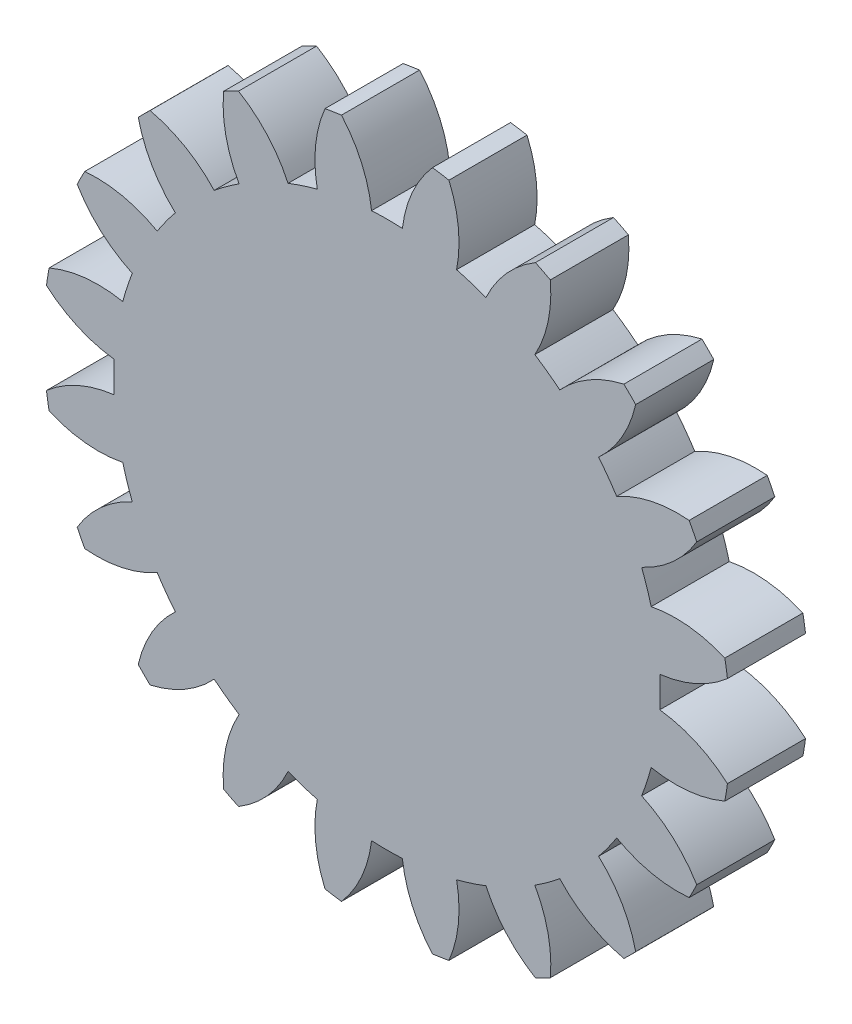
from build123d import *

# Parameters (mm, degrees)
BOSS_EXTRUDE1_DEPTH = 5


with BuildPart() as part:
    # Sketch1 → Boss-Extrude1 (new body)
    with BuildSketch(Plane.XY):
        with BuildLine():
            ThreePointArc((-21.806333941, 2.912696354), (-19.784848102, 1.620704589), (-17.471189616, 0.986171591))
            ThreePointArc((-17.471189616, 0.986171591), (-17.499, 0), (-17.471189616, -0.986171591))
            ThreePointArc((-17.471189616, -0.986171591), (-19.784848102, -1.620704589), (-21.806333941, -2.912696354))
            ThreePointArc((-21.806333941, -2.912696354), (-21.729143493, -3.441558231), (-21.639128664, -3.968388926))
            ThreePointArc((-21.639128664, -3.968388926), (-19.317333972, -4.572472634), (-16.920832513, -4.460989585))
            ThreePointArc((-16.920832513, -4.460989585), (-16.642537979, -5.407488385), (-16.31134495, -6.336799421))
            ThreePointArc((-16.31134495, -6.336799421), (-18.31568345, -7.655235955), (-19.838983319, -9.50866662))
            ThreePointArc((-19.838983319, -9.50866662), (-19.602143532, -9.987790994), (-19.353734704, -10.461020648))
            ThreePointArc((-19.353734704, -10.461020648), (-16.958904602, -10.318064378), (-14.714146429, -9.471478019))
            ThreePointArc((-14.714146429, -9.471478019), (-14.156988385, -10.28565413), (-13.554832194, -11.067137173))
            ThreePointArc((-13.554832194, -11.067137173), (-15.05365209, -12.940419489), (-15.929654782, -15.173862347))
            ThreePointArc((-15.929654782, -15.173862347), (-15.556349186, -15.556349186), (-15.173862347, -15.929654782))
            ThreePointArc((-15.173862347, -15.929654782), (-12.940419489, -15.05365209), (-11.067137173, -13.554832194))
            ThreePointArc((-11.067137173, -13.554832194), (-10.28565413, -14.156988385), (-9.471478019, -14.714146429))
            ThreePointArc((-9.471478019, -14.714146429), (-10.318064378, -16.958904602), (-10.461020648, -19.353734704))
            ThreePointArc((-10.461020648, -19.353734704), (-9.987790994, -19.602143532), (-9.50866662, -19.838983319))
            ThreePointArc((-9.50866662, -19.838983319), (-7.655235955, -18.31568345), (-6.336799421, -16.31134495))
            ThreePointArc((-6.336799421, -16.31134495), (-5.407488385, -16.642537979), (-4.460989585, -16.920832513))
            ThreePointArc((-4.460989585, -16.920832513), (-4.572472634, -19.317333972), (-3.968388926, -21.639128664))
            ThreePointArc((-3.968388926, -21.639128664), (-3.441558231, -21.729143493), (-2.912696354, -21.806333941))
            ThreePointArc((-2.912696354, -21.806333941), (-1.620704589, -19.784848102), (-0.986171591, -17.471189616))
            ThreePointArc((-0.986171591, -17.471189616), (0, -17.499), (0.986171591, -17.471189616))
            ThreePointArc((0.986171591, -17.471189616), (1.620704589, -19.784848102), (2.912696354, -21.806333941))
            ThreePointArc((2.912696354, -21.806333941), (3.441558231, -21.729143493), (3.968388926, -21.639128664))
            ThreePointArc((3.968388926, -21.639128664), (4.572472634, -19.317333972), (4.460989585, -16.920832513))
            ThreePointArc((4.460989585, -16.920832513), (5.407488385, -16.642537979), (6.336799421, -16.31134495))
            ThreePointArc((6.336799421, -16.31134495), (7.655235955, -18.31568345), (9.50866662, -19.838983319))
            ThreePointArc((9.50866662, -19.838983319), (9.987790994, -19.602143532), (10.461020648, -19.353734704))
            ThreePointArc((10.461020648, -19.353734704), (10.318064378, -16.958904602), (9.471478019, -14.714146429))
            ThreePointArc((9.471478019, -14.714146429), (10.28565413, -14.156988385), (11.067137173, -13.554832194))
            ThreePointArc((11.067137173, -13.554832194), (12.940419489, -15.05365209), (15.173862347, -15.929654782))
            ThreePointArc((15.173862347, -15.929654782), (15.556349186, -15.556349186), (15.929654782, -15.173862347))
            ThreePointArc((15.929654782, -15.173862347), (15.05365209, -12.940419489), (13.554832194, -11.067137173))
            ThreePointArc((13.554832194, -11.067137173), (14.156988385, -10.28565413), (14.714146429, -9.471478019))
            ThreePointArc((14.714146429, -9.471478019), (16.958904602, -10.318064378), (19.353734704, -10.461020648))
            ThreePointArc((19.353734704, -10.461020648), (19.602143532, -9.987790994), (19.838983319, -9.50866662))
            ThreePointArc((19.838983319, -9.50866662), (18.31568345, -7.655235955), (16.31134495, -6.336799421))
            ThreePointArc((16.31134495, -6.336799421), (16.642537979, -5.407488385), (16.920832513, -4.460989585))
            ThreePointArc((16.920832513, -4.460989585), (19.317333972, -4.572472634), (21.639128664, -3.968388926))
            ThreePointArc((21.639128664, -3.968388926), (21.729143493, -3.441558231), (21.806333941, -2.912696354))
            ThreePointArc((21.806333941, -2.912696354), (19.784848102, -1.620704589), (17.471189616, -0.986171591))
            ThreePointArc((17.471189616, -0.986171591), (17.499, 0), (17.471189616, 0.986171591))
            ThreePointArc((17.471189616, 0.986171591), (19.784848102, 1.620704589), (21.806333941, 2.912696354))
            ThreePointArc((21.806333941, 2.912696354), (21.729143493, 3.441558231), (21.639128664, 3.968388926))
            ThreePointArc((21.639128664, 3.968388926), (19.317333972, 4.572472634), (16.920832513, 4.460989585))
            ThreePointArc((16.920832513, 4.460989585), (16.642537979, 5.407488385), (16.31134495, 6.336799421))
            ThreePointArc((16.31134495, 6.336799421), (18.31568345, 7.655235955), (19.838983319, 9.50866662))
            ThreePointArc((19.838983319, 9.50866662), (19.602143532, 9.987790994), (19.353734704, 10.461020648))
            ThreePointArc((19.353734704, 10.461020648), (16.958904602, 10.318064378), (14.714146429, 9.471478019))
            ThreePointArc((14.714146429, 9.471478019), (14.156988385, 10.28565413), (13.554832194, 11.067137173))
            ThreePointArc((13.554832194, 11.067137173), (15.05365209, 12.940419489), (15.929654782, 15.173862347))
            ThreePointArc((15.929654782, 15.173862347), (15.556349186, 15.556349186), (15.173862347, 15.929654782))
            ThreePointArc((15.173862347, 15.929654782), (12.940419489, 15.05365209), (11.067137173, 13.554832194))
            ThreePointArc((11.067137173, 13.554832194), (10.28565413, 14.156988385), (9.471478019, 14.714146429))
            ThreePointArc((9.471478019, 14.714146429), (10.318064378, 16.958904602), (10.461020648, 19.353734704))
            ThreePointArc((10.461020648, 19.353734704), (9.987790994, 19.602143532), (9.50866662, 19.838983319))
            ThreePointArc((9.50866662, 19.838983319), (7.655235955, 18.31568345), (6.336799421, 16.31134495))
            ThreePointArc((6.336799421, 16.31134495), (5.407488385, 16.642537979), (4.460989585, 16.920832513))
            ThreePointArc((4.460989585, 16.920832513), (4.572472634, 19.317333972), (3.968388926, 21.639128664))
            ThreePointArc((3.968388926, 21.639128664), (3.441558231, 21.729143493), (2.912696354, 21.806333941))
            ThreePointArc((2.912696354, 21.806333941), (1.620704589, 19.784848102), (0.986171591, 17.471189616))
            ThreePointArc((0.986171591, 17.471189616), (0, 17.499), (-0.986171591, 17.471189616))
            ThreePointArc((-0.986171591, 17.471189616), (-1.620704589, 19.784848102), (-2.912696354, 21.806333941))
            ThreePointArc((-2.912696354, 21.806333941), (-3.441558231, 21.729143493), (-3.968388926, 21.639128664))
            ThreePointArc((-3.968388926, 21.639128664), (-4.572472634, 19.317333972), (-4.460989585, 16.920832513))
            ThreePointArc((-4.460989585, 16.920832513), (-5.407488385, 16.642537979), (-6.336799421, 16.31134495))
            ThreePointArc((-6.336799421, 16.31134495), (-7.655235955, 18.31568345), (-9.50866662, 19.838983319))
            ThreePointArc((-9.50866662, 19.838983319), (-9.987790994, 19.602143532), (-10.461020648, 19.353734704))
            ThreePointArc((-10.461020648, 19.353734704), (-10.318064378, 16.958904602), (-9.471478019, 14.714146429))
            ThreePointArc((-9.471478019, 14.714146429), (-10.28565413, 14.156988385), (-11.067137173, 13.554832194))
            ThreePointArc((-11.067137173, 13.554832194), (-12.940419489, 15.05365209), (-15.173862347, 15.929654782))
            ThreePointArc((-15.173862347, 15.929654782), (-15.556349186, 15.556349186), (-15.929654782, 15.173862347))
            ThreePointArc((-15.929654782, 15.173862347), (-15.05365209, 12.940419489), (-13.554832194, 11.067137173))
            ThreePointArc((-13.554832194, 11.067137173), (-14.156988385, 10.28565413), (-14.714146429, 9.471478019))
            ThreePointArc((-14.714146429, 9.471478019), (-16.958904602, 10.318064378), (-19.353734704, 10.461020648))
            ThreePointArc((-19.353734704, 10.461020648), (-19.602143532, 9.987790994), (-19.838983319, 9.50866662))
            ThreePointArc((-19.838983319, 9.50866662), (-18.31568345, 7.655235955), (-16.31134495, 6.336799421))
            ThreePointArc((-16.31134495, 6.336799421), (-16.642537979, 5.407488385), (-16.920832513, 4.460989585))
            ThreePointArc((-16.920832513, 4.460989585), (-19.317333972, 4.572472634), (-21.639128664, 3.968388926))
            ThreePointArc((-21.639128664, 3.968388926), (-21.729143493, 3.441558231), (-21.806333941, 2.912696354))
        make_face()
    extrude(amount=BOSS_EXTRUDE1_DEPTH)


solid = part.part
